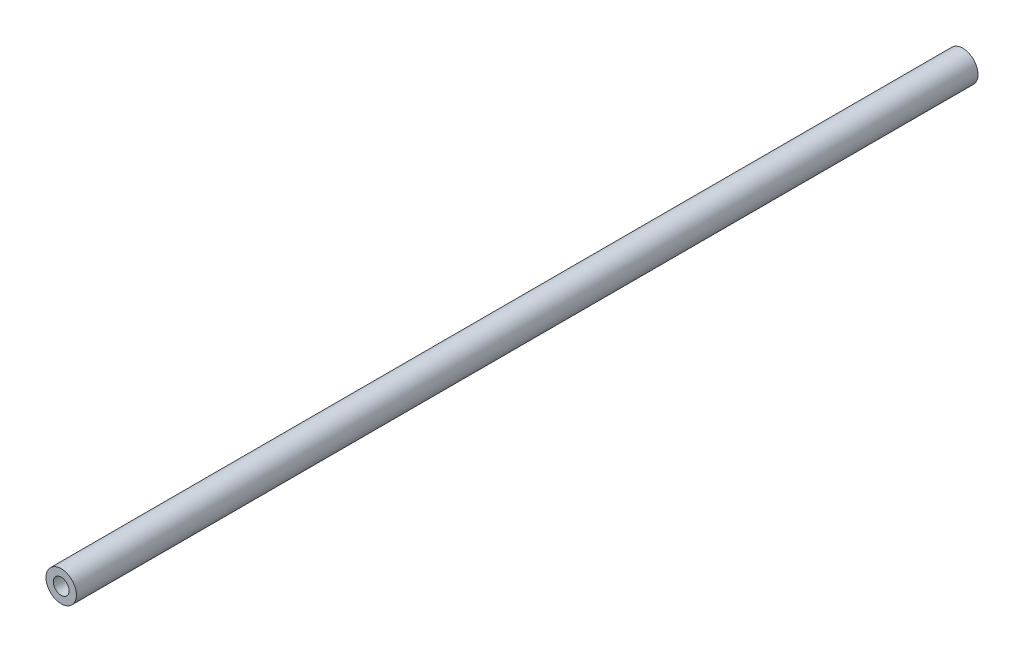
from build123d import *

# Parameters (mm, degrees)
SKETCH1_R           = 0.17145
SKETCH1_R_2         = 0.0889
BOSS_EXTRUDE1_DEPTH = 10.16


with BuildPart() as part:
    # Sketch1 → Boss-Extrude1 (new body)
    with BuildSketch(Plane.XY):
        Circle(SKETCH1_R)
        Circle(SKETCH1_R_2, mode=Mode.SUBTRACT)
    extrude(amount=BOSS_EXTRUDE1_DEPTH)


solid = part.part
